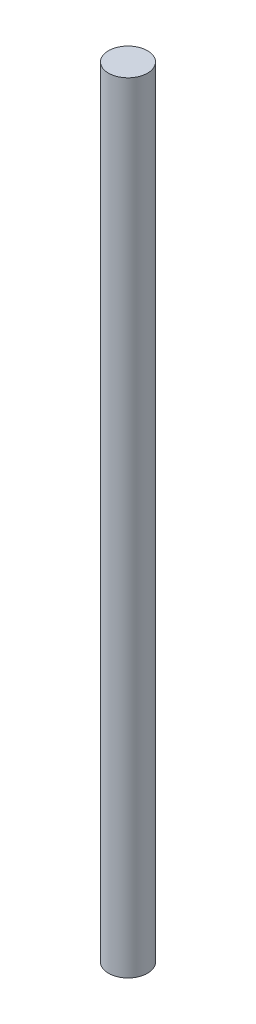
from build123d import *

# Parameters (mm, degrees)
CROQUIS1_R              = 2.5
SALIENTE_EXTRUIR1_DEPTH = 100


with BuildPart() as part:
    # Croquis1 → Saliente-Extruir1 (new body)
    with BuildSketch(Plane(origin=(0, 0, 0), x_dir=(1, 0, 0), z_dir=(0, 1, 0))):
        with Locations(Location((0, 0, 0), (0, 0, 270))):
            Circle(CROQUIS1_R)
    extrude(amount=SALIENTE_EXTRUIR1_DEPTH)


solid = part.part
